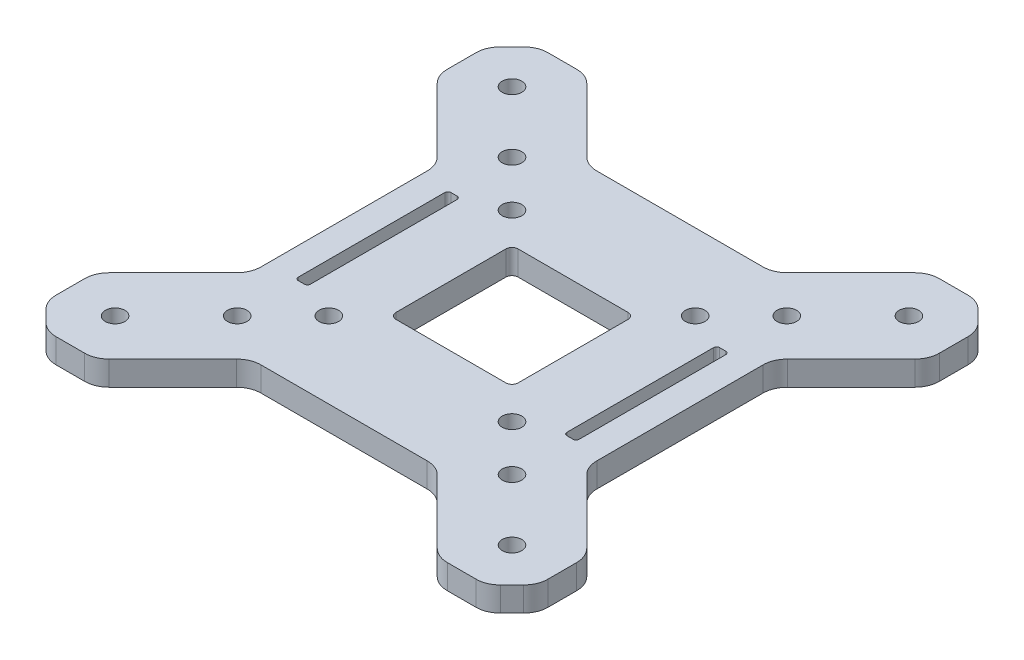
from build123d import *

# Parameters (mm, degrees)
BOSS_EXTRUDE1_DEPTH = 4
FILLET1_R           = 4
SKETCH2_W           = 20
SKETCH2_H           = 20
SKETCH2_W_2         = 2
SKETCH2_H_2         = 25
CUT_EXTRUDE1_DEPTH  = 4
FILLET2_R           = 1
FILLET3_R           = 0.5
FILLET4_R           = 0.5


with BuildPart() as part:
    # Sketch1 → Boss-Extrude1 (new body)
    with BuildSketch(Plane(origin=(0, 0, 0), x_dir=(1, 0, 0), z_dir=(0, 1, 0))):
        with BuildLine():
            Line((-32.5, -30.9), (-32.5, -23.50217812))
            ThreePointArc((-32.5, -23.50217812), (-33.389914379, -22.768338823), (-34.291390983, -22.048750296))
            Line((-34.291390983, -22.048750296), (-40.278174593, -28.035533906))
            Line((-40.278174593, -28.035533906), (-40.278174593, -36.035533906))
            Line((-40.278174593, -36.035533906), (-38.156854249, -38.156854249))
            Line((-38.156854249, -38.156854249), (-33.63137085, -33.63137085))
            ThreePointArc((-33.63137085, -33.63137085), (-33.978207252, -31.887706508), (-32.5, -30.9))
        make_face()
        with BuildLine():
            ThreePointArc((-22.048750296, -34.291390983), (-22.768338823, -33.389914379), (-23.50217812, -32.5))
            Line((-23.50217812, -32.5), (-30.9, -32.5))
            ThreePointArc((-30.9, -32.5), (-31.887706508, -33.978207252), (-33.63137085, -33.63137085))
            Line((-33.63137085, -33.63137085), (-38.156854249, -38.156854249))
            Line((-38.156854249, -38.156854249), (-36.035533906, -40.278174593))
            Line((-36.035533906, -40.278174593), (-28.035533906, -40.278174593))
            Line((-28.035533906, -40.278174593), (-22.048750296, -34.291390983))
        make_face()
        with BuildLine():
            Line((-32.5, -23.50217812), (-32.5, -20.257359313))
            Line((-32.5, -20.257359313), (-34.291390983, -22.048750296))
            ThreePointArc((-34.291390983, -22.048750296), (-33.389914379, -22.768338823), (-32.5, -23.50217812))
        make_face()
        with BuildLine():
            Line((-22.048750296, -34.291390983), (-20.257359313, -32.5))
            Line((-20.257359313, -32.5), (-23.50217812, -32.5))
            ThreePointArc((-23.50217812, -32.5), (-22.768338823, -33.389914379), (-22.048750296, -34.291390983))
        make_face()
        with BuildLine():
            Line((-15.257359313, -27.5), (-27.5, -27.5))
            Line((-27.5, -27.5), (-27.803300859, -27.803300859))
            ThreePointArc((-27.803300859, -27.803300859), (-25.601143489, -30.104400069), (-23.50217812, -32.5))
            Line((-23.50217812, -32.5), (-20.257359313, -32.5))
            Line((-20.257359313, -32.5), (-15.257359313, -27.5))
        make_face()
        with BuildLine():
            Line((-27.803300859, -27.803300859), (-27.5, -27.5))
            Line((-27.5, -27.5), (-27.5, -15.257359313))
            Line((-27.5, -15.257359313), (-32.5, -20.257359313))
            Line((-32.5, -20.257359313), (-32.5, -23.50217812))
            ThreePointArc((-32.5, -23.50217812), (-30.104400069, -25.601143489), (-27.803300859, -27.803300859))
        make_face()
        with BuildLine():
            Line((-31.36862915, -31.36862915), (-27.803300859, -27.803300859))
            ThreePointArc((-27.803300859, -27.803300859), (-30.104400069, -25.601143489), (-32.5, -23.50217812))
            Line((-32.5, -23.50217812), (-32.5, -30.9))
            ThreePointArc((-32.5, -30.9), (-31.887706508, -31.021792748), (-31.36862915, -31.36862915))
        make_face()
        with BuildLine():
            ThreePointArc((-23.50217812, -32.5), (-25.601143489, -30.104400069), (-27.803300859, -27.803300859))
            Line((-27.803300859, -27.803300859), (-31.36862915, -31.36862915))
            ThreePointArc((-31.36862915, -31.36862915), (-31.021792748, -31.887706508), (-30.9, -32.5))
            Line((-30.9, -32.5), (-23.50217812, -32.5))
        make_face()
        with BuildLine():
            ThreePointArc((-23.63137085, -23.63137085), (-23.978207252, -21.887706508), (-22.5, -20.9))
            Line((-22.5, -20.9), (-22.5, -10.257359313))
            Line((-22.5, -10.257359313), (-27.5, -15.257359313))
            Line((-27.5, -15.257359313), (-27.5, -27.5))
            Line((-27.5, -27.5), (-23.63137085, -23.63137085))
        make_face()
        with BuildLine():
            Line((-10.257359313, -22.5), (-20.9, -22.5))
            ThreePointArc((-20.9, -22.5), (-21.887706508, -23.978207252), (-23.63137085, -23.63137085))
            Line((-23.63137085, -23.63137085), (-27.5, -27.5))
            Line((-27.5, -27.5), (-15.257359313, -27.5))
            Line((-15.257359313, -27.5), (-10.257359313, -22.5))
        make_face()
        with BuildLine():
            ThreePointArc((-16.13137085, -16.13137085), (-16.478207252, -14.387706508), (-15, -13.4))
            Line((-15, -13.4), (-15, 13.4))
            ThreePointArc((-15, 13.4), (-16.478207252, 14.387706508), (-16.13137085, 16.13137085))
            Line((-16.13137085, 16.13137085), (-21.36862915, 21.36862915))
            ThreePointArc((-21.36862915, 21.36862915), (-21.887706508, 21.021792748), (-22.5, 20.9))
            Line((-22.5, 20.9), (-22.5, 10.257359313))
            Line((-22.5, 10.257359313), (-22.5, -10.257359313))
            Line((-22.5, -10.257359313), (-22.5, -20.9))
            ThreePointArc((-22.5, -20.9), (-21.887706508, -21.021792748), (-21.36862915, -21.36862915))
            Line((-21.36862915, -21.36862915), (-16.13137085, -16.13137085))
        make_face()
        with BuildLine():
            ThreePointArc((16.13137085, -16.13137085), (14.387706508, -16.478207252), (13.4, -15))
            Line((13.4, -15), (-13.4, -15))
            ThreePointArc((-13.4, -15), (-14.387706508, -16.478207252), (-16.13137085, -16.13137085))
            Line((-16.13137085, -16.13137085), (-21.36862915, -21.36862915))
            ThreePointArc((-21.36862915, -21.36862915), (-21.021792748, -21.887706508), (-20.9, -22.5))
            Line((-20.9, -22.5), (-10.257359313, -22.5))
            Line((-10.257359313, -22.5), (10.257359313, -22.5))
            Line((10.257359313, -22.5), (20.9, -22.5))
            ThreePointArc((20.9, -22.5), (21.021792748, -21.887706508), (21.36862915, -21.36862915))
            Line((21.36862915, -21.36862915), (16.13137085, -16.13137085))
        make_face()
        Polygon((-27.5, -15.257359313), (-22.5, -10.257359313), (-22.5, 10.257359313), (-27.5, 15.257359313), align=None)
        Polygon((15.257359313, -27.5), (10.257359313, -22.5), (-10.257359313, -22.5), (-15.257359313, -27.5), align=None)
        with BuildLine():
            ThreePointArc((23.63137085, -23.63137085), (21.887706508, -23.978207252), (20.9, -22.5))
            Line((20.9, -22.5), (10.257359313, -22.5))
            Line((10.257359313, -22.5), (15.257359313, -27.5))
            Line((15.257359313, -27.5), (27.5, -27.5))
            Line((27.5, -27.5), (23.63137085, -23.63137085))
        make_face()
        with BuildLine():
            Line((22.5, -10.257359313), (22.5, -20.9))
            ThreePointArc((22.5, -20.9), (23.63137085, -21.36862915), (24.1, -22.5))
            ThreePointArc((24.1, -22.5), (23.978207252, -23.112293492), (23.63137085, -23.63137085))
            Line((23.63137085, -23.63137085), (27.5, -27.5))
            Line((27.5, -27.5), (27.5, -15.257359313))
            Line((27.5, -15.257359313), (22.5, -10.257359313))
        make_face()
        with BuildLine():
            ThreePointArc((16.6, 15), (16.13137085, 13.86862915), (15, 13.4))
            Line((15, 13.4), (15, -13.4))
            ThreePointArc((15, -13.4), (16.13137085, -13.86862915), (16.6, -15))
            ThreePointArc((16.6, -15), (16.478207252, -15.612293492), (16.13137085, -16.13137085))
            Line((16.13137085, -16.13137085), (21.36862915, -21.36862915))
            ThreePointArc((21.36862915, -21.36862915), (21.887706508, -21.021792748), (22.5, -20.9))
            Line((22.5, -20.9), (22.5, -10.257359313))
            Line((22.5, -10.257359313), (22.5, 10.257359313))
            Line((22.5, 10.257359313), (22.5, 20.9))
            ThreePointArc((22.5, 20.9), (21.887706508, 21.021792748), (21.36862915, 21.36862915))
            Line((21.36862915, 21.36862915), (16.13137085, 16.13137085))
            ThreePointArc((16.13137085, 16.13137085), (16.478207252, 15.612293492), (16.6, 15))
        make_face()
        Polygon((27.5, 15.257359313), (22.5, 10.257359313), (22.5, -10.257359313), (27.5, -15.257359313), align=None)
        with BuildLine():
            Line((27.5, -15.257359313), (27.5, -27.5))
            Line((27.5, -27.5), (27.803300859, -27.803300859))
            ThreePointArc((27.803300859, -27.803300859), (30.104400069, -25.601143489), (32.5, -23.50217812))
            Line((32.5, -23.50217812), (32.5, -20.257359313))
            Line((32.5, -20.257359313), (27.5, -15.257359313))
        make_face()
        with BuildLine():
            Line((27.803300859, -27.803300859), (27.5, -27.5))
            Line((27.5, -27.5), (15.257359313, -27.5))
            Line((15.257359313, -27.5), (20.257359313, -32.5))
            Line((20.257359313, -32.5), (23.50217812, -32.5))
            ThreePointArc((23.50217812, -32.5), (25.601143489, -30.104400069), (27.803300859, -27.803300859))
        make_face()
        with BuildLine():
            Line((31.36862915, -31.36862915), (27.803300859, -27.803300859))
            ThreePointArc((27.803300859, -27.803300859), (25.601143489, -30.104400069), (23.50217812, -32.5))
            Line((23.50217812, -32.5), (30.9, -32.5))
            ThreePointArc((30.9, -32.5), (31.021792748, -31.887706508), (31.36862915, -31.36862915))
        make_face()
        with BuildLine():
            ThreePointArc((32.5, -23.50217812), (30.104400069, -25.601143489), (27.803300859, -27.803300859))
            Line((27.803300859, -27.803300859), (31.36862915, -31.36862915))
            ThreePointArc((31.36862915, -31.36862915), (31.887706508, -31.021792748), (32.5, -30.9))
            Line((32.5, -30.9), (32.5, -23.50217812))
        make_face()
        with BuildLine():
            Line((30.9, -32.5), (23.50217812, -32.5))
            ThreePointArc((23.50217812, -32.5), (22.768338823, -33.389914379), (22.048750296, -34.291390983))
            Line((22.048750296, -34.291390983), (28.035533906, -40.278174593))
            Line((28.035533906, -40.278174593), (36.035533906, -40.278174593))
            Line((36.035533906, -40.278174593), (38.156854249, -38.156854249))
            Line((38.156854249, -38.156854249), (33.63137085, -33.63137085))
            ThreePointArc((33.63137085, -33.63137085), (31.887706508, -33.978207252), (30.9, -32.5))
        make_face()
        with BuildLine():
            Line((23.50217812, -32.5), (20.257359313, -32.5))
            Line((20.257359313, -32.5), (22.048750296, -34.291390983))
            ThreePointArc((22.048750296, -34.291390983), (22.768338823, -33.389914379), (23.50217812, -32.5))
        make_face()
        with BuildLine():
            Line((34.291390983, -22.048750296), (32.5, -20.257359313))
            Line((32.5, -20.257359313), (32.5, -23.50217812))
            ThreePointArc((32.5, -23.50217812), (33.389914379, -22.768338823), (34.291390983, -22.048750296))
        make_face()
        with BuildLine():
            ThreePointArc((34.291390983, -22.048750296), (33.389914379, -22.768338823), (32.5, -23.50217812))
            Line((32.5, -23.50217812), (32.5, -30.9))
            ThreePointArc((32.5, -30.9), (33.63137085, -31.36862915), (34.1, -32.5))
            ThreePointArc((34.1, -32.5), (33.978207252, -33.112293492), (33.63137085, -33.63137085))
            Line((33.63137085, -33.63137085), (38.156854249, -38.156854249))
            Line((38.156854249, -38.156854249), (40.278174593, -36.035533906))
            Line((40.278174593, -36.035533906), (40.278174593, -28.035533906))
            Line((40.278174593, -28.035533906), (34.291390983, -22.048750296))
        make_face()
        with BuildLine():
            Line((13.86862915, -13.86862915), (0, 0))
            Line((0, 0), (-13.86862915, -13.86862915))
            ThreePointArc((-13.86862915, -13.86862915), (-13.521792748, -14.387706508), (-13.4, -15))
            Line((-13.4, -15), (13.4, -15))
            ThreePointArc((13.4, -15), (13.521792748, -14.387706508), (13.86862915, -13.86862915))
        make_face()
        with BuildLine():
            Line((-13.86862915, -13.86862915), (0, 0))
            Line((0, 0), (-13.86862915, 13.86862915))
            ThreePointArc((-13.86862915, 13.86862915), (-14.387706508, 13.521792748), (-15, 13.4))
            Line((-15, 13.4), (-15, -13.4))
            ThreePointArc((-15, -13.4), (-14.387706508, -13.521792748), (-13.86862915, -13.86862915))
        make_face()
        with BuildLine():
            Line((-13.86862915, 13.86862915), (0, 0))
            Line((0, 0), (13.86862915, 13.86862915))
            ThreePointArc((13.86862915, 13.86862915), (13.521792748, 14.387706508), (13.4, 15))
            Line((13.4, 15), (-13.4, 15))
            ThreePointArc((-13.4, 15), (-13.521792748, 14.387706508), (-13.86862915, 13.86862915))
        make_face()
        with BuildLine():
            Line((13.86862915, 13.86862915), (0, 0))
            Line((0, 0), (13.86862915, -13.86862915))
            ThreePointArc((13.86862915, -13.86862915), (14.387706508, -13.521792748), (15, -13.4))
            Line((15, -13.4), (15, 13.4))
            ThreePointArc((15, 13.4), (14.387706508, 13.521792748), (13.86862915, 13.86862915))
        make_face()
        with BuildLine():
            Line((-13.4, 15), (13.4, 15))
            ThreePointArc((13.4, 15), (14.387706508, 16.478207252), (16.13137085, 16.13137085))
            Line((16.13137085, 16.13137085), (21.36862915, 21.36862915))
            ThreePointArc((21.36862915, 21.36862915), (21.021792748, 21.887706508), (20.9, 22.5))
            Line((20.9, 22.5), (10.257359313, 22.5))
            Line((10.257359313, 22.5), (-10.257359313, 22.5))
            Line((-10.257359313, 22.5), (-20.9, 22.5))
            ThreePointArc((-20.9, 22.5), (-21.021792748, 21.887706508), (-21.36862915, 21.36862915))
            Line((-21.36862915, 21.36862915), (-16.13137085, 16.13137085))
            ThreePointArc((-16.13137085, 16.13137085), (-14.387706508, 16.478207252), (-13.4, 15))
        make_face()
        Polygon((-10.257359313, 22.5), (10.257359313, 22.5), (15.257359313, 27.5), (-15.257359313, 27.5), align=None)
        with BuildLine():
            ThreePointArc((-23.63137085, 23.63137085), (-21.887706508, 23.978207252), (-20.9, 22.5))
            Line((-20.9, 22.5), (-10.257359313, 22.5))
            Line((-10.257359313, 22.5), (-15.257359313, 27.5))
            Line((-15.257359313, 27.5), (-27.5, 27.5))
            Line((-27.5, 27.5), (-23.63137085, 23.63137085))
        make_face()
        with BuildLine():
            Line((10.257359313, 22.5), (20.9, 22.5))
            ThreePointArc((20.9, 22.5), (21.887706508, 23.978207252), (23.63137085, 23.63137085))
            Line((23.63137085, 23.63137085), (27.5, 27.5))
            Line((27.5, 27.5), (15.257359313, 27.5))
            Line((15.257359313, 27.5), (10.257359313, 22.5))
        make_face()
        with BuildLine():
            ThreePointArc((24.1, 22.5), (23.63137085, 21.36862915), (22.5, 20.9))
            Line((22.5, 20.9), (22.5, 10.257359313))
            Line((22.5, 10.257359313), (27.5, 15.257359313))
            Line((27.5, 15.257359313), (27.5, 27.5))
            Line((27.5, 27.5), (23.63137085, 23.63137085))
            ThreePointArc((23.63137085, 23.63137085), (23.978207252, 23.112293492), (24.1, 22.5))
        make_face()
        with BuildLine():
            Line((27.803300859, 27.803300859), (27.5, 27.5))
            Line((27.5, 27.5), (27.5, 15.257359313))
            Line((27.5, 15.257359313), (32.5, 20.257359313))
            Line((32.5, 20.257359313), (32.5, 23.50217812))
            ThreePointArc((32.5, 23.50217812), (30.104400069, 25.601143489), (27.803300859, 27.803300859))
        make_face()
        with BuildLine():
            Line((15.257359313, 27.5), (27.5, 27.5))
            Line((27.5, 27.5), (27.803300859, 27.803300859))
            ThreePointArc((27.803300859, 27.803300859), (25.601143489, 30.104400069), (23.50217812, 32.5))
            Line((23.50217812, 32.5), (20.257359313, 32.5))
            Line((20.257359313, 32.5), (15.257359313, 27.5))
        make_face()
        with BuildLine():
            Line((-27.5, 15.257359313), (-27.5, 27.5))
            Line((-27.5, 27.5), (-27.803300859, 27.803300859))
            ThreePointArc((-27.803300859, 27.803300859), (-30.104400069, 25.601143489), (-32.5, 23.50217812))
            Line((-32.5, 23.50217812), (-32.5, 20.257359313))
            Line((-32.5, 20.257359313), (-27.5, 15.257359313))
        make_face()
        with BuildLine():
            Line((-31.36862915, 31.36862915), (-27.803300859, 27.803300859))
            ThreePointArc((-27.803300859, 27.803300859), (-25.601143489, 30.104400069), (-23.50217812, 32.5))
            Line((-23.50217812, 32.5), (-30.9, 32.5))
            ThreePointArc((-30.9, 32.5), (-31.021792748, 31.887706508), (-31.36862915, 31.36862915))
        make_face()
        with BuildLine():
            Line((-22.5, 10.257359313), (-22.5, 20.9))
            ThreePointArc((-22.5, 20.9), (-23.978207252, 21.887706508), (-23.63137085, 23.63137085))
            Line((-23.63137085, 23.63137085), (-27.5, 27.5))
            Line((-27.5, 27.5), (-27.5, 15.257359313))
            Line((-27.5, 15.257359313), (-22.5, 10.257359313))
        make_face()
        with BuildLine():
            Line((-27.803300859, 27.803300859), (-27.5, 27.5))
            Line((-27.5, 27.5), (-15.257359313, 27.5))
            Line((-15.257359313, 27.5), (-20.257359313, 32.5))
            Line((-20.257359313, 32.5), (-23.50217812, 32.5))
            ThreePointArc((-23.50217812, 32.5), (-25.601143489, 30.104400069), (-27.803300859, 27.803300859))
        make_face()
        with BuildLine():
            ThreePointArc((-32.5, 23.50217812), (-30.104400069, 25.601143489), (-27.803300859, 27.803300859))
            Line((-27.803300859, 27.803300859), (-31.36862915, 31.36862915))
            ThreePointArc((-31.36862915, 31.36862915), (-31.887706508, 31.021792748), (-32.5, 30.9))
            Line((-32.5, 30.9), (-32.5, 23.50217812))
        make_face()
        with BuildLine():
            ThreePointArc((-34.291390983, 22.048750296), (-33.389914379, 22.768338823), (-32.5, 23.50217812))
            Line((-32.5, 23.50217812), (-32.5, 30.9))
            ThreePointArc((-32.5, 30.9), (-33.978207252, 31.887706508), (-33.63137085, 33.63137085))
            Line((-33.63137085, 33.63137085), (-38.156854249, 38.156854249))
            Line((-38.156854249, 38.156854249), (-40.278174593, 36.035533906))
            Line((-40.278174593, 36.035533906), (-40.278174593, 28.035533906))
            Line((-40.278174593, 28.035533906), (-34.291390983, 22.048750296))
        make_face()
        with BuildLine():
            Line((-30.9, 32.5), (-23.50217812, 32.5))
            ThreePointArc((-23.50217812, 32.5), (-22.768338823, 33.389914379), (-22.048750296, 34.291390983))
            Line((-22.048750296, 34.291390983), (-28.035533906, 40.278174593))
            Line((-28.035533906, 40.278174593), (-36.035533906, 40.278174593))
            Line((-36.035533906, 40.278174593), (-38.156854249, 38.156854249))
            Line((-38.156854249, 38.156854249), (-33.63137085, 33.63137085))
            ThreePointArc((-33.63137085, 33.63137085), (-31.887706508, 33.978207252), (-30.9, 32.5))
        make_face()
        with BuildLine():
            Line((-23.50217812, 32.5), (-20.257359313, 32.5))
            Line((-20.257359313, 32.5), (-22.048750296, 34.291390983))
            ThreePointArc((-22.048750296, 34.291390983), (-22.768338823, 33.389914379), (-23.50217812, 32.5))
        make_face()
        with BuildLine():
            Line((-34.291390983, 22.048750296), (-32.5, 20.257359313))
            Line((-32.5, 20.257359313), (-32.5, 23.50217812))
            ThreePointArc((-32.5, 23.50217812), (-33.389914379, 22.768338823), (-34.291390983, 22.048750296))
        make_face()
        with BuildLine():
            ThreePointArc((23.50217812, 32.5), (25.601143489, 30.104400069), (27.803300859, 27.803300859))
            Line((27.803300859, 27.803300859), (31.36862915, 31.36862915))
            ThreePointArc((31.36862915, 31.36862915), (31.021792748, 31.887706508), (30.9, 32.5))
            Line((30.9, 32.5), (23.50217812, 32.5))
        make_face()
        with BuildLine():
            ThreePointArc((22.048750296, 34.291390983), (22.768338823, 33.389914379), (23.50217812, 32.5))
            Line((23.50217812, 32.5), (30.9, 32.5))
            ThreePointArc((30.9, 32.5), (31.887706508, 33.978207252), (33.63137085, 33.63137085))
            Line((33.63137085, 33.63137085), (38.156854249, 38.156854249))
            Line((38.156854249, 38.156854249), (36.035533906, 40.278174593))
            Line((36.035533906, 40.278174593), (28.035533906, 40.278174593))
            Line((28.035533906, 40.278174593), (22.048750296, 34.291390983))
        make_face()
        with BuildLine():
            Line((22.048750296, 34.291390983), (20.257359313, 32.5))
            Line((20.257359313, 32.5), (23.50217812, 32.5))
            ThreePointArc((23.50217812, 32.5), (22.768338823, 33.389914379), (22.048750296, 34.291390983))
        make_face()
        with BuildLine():
            Line((32.5, 23.50217812), (32.5, 20.257359313))
            Line((32.5, 20.257359313), (34.291390983, 22.048750296))
            ThreePointArc((34.291390983, 22.048750296), (33.389914379, 22.768338823), (32.5, 23.50217812))
        make_face()
        with BuildLine():
            Line((32.5, 30.9), (32.5, 23.50217812))
            ThreePointArc((32.5, 23.50217812), (33.389914379, 22.768338823), (34.291390983, 22.048750296))
            Line((34.291390983, 22.048750296), (40.278174593, 28.035533906))
            Line((40.278174593, 28.035533906), (40.278174593, 36.035533906))
            Line((40.278174593, 36.035533906), (38.156854249, 38.156854249))
            Line((38.156854249, 38.156854249), (33.63137085, 33.63137085))
            ThreePointArc((33.63137085, 33.63137085), (33.978207252, 33.112293492), (34.1, 32.5))
            ThreePointArc((34.1, 32.5), (33.63137085, 31.36862915), (32.5, 30.9))
        make_face()
        with BuildLine():
            Line((31.36862915, 31.36862915), (27.803300859, 27.803300859))
            ThreePointArc((27.803300859, 27.803300859), (30.104400069, 25.601143489), (32.5, 23.50217812))
            Line((32.5, 23.50217812), (32.5, 30.9))
            ThreePointArc((32.5, 30.9), (31.887706508, 31.021792748), (31.36862915, 31.36862915))
        make_face()
    extrude(amount=BOSS_EXTRUDE1_DEPTH)

    # Fillet1
    fillet1_edges = [part.edges().sort_by_distance(p)[0] for p in [
        (28.035533906, 2, 40.278174593),
        (15.257359313, 2, 27.5),
        (-15.257359313, 2, 27.5),
        (-28.035533906, 2, 40.278174593),
        (-36.035533906, 2, 40.278174593),
        (-40.278174593, 2, 36.035533906),
        (-40.278174593, 2, 28.035533906),
        (-27.5, 2, 15.257359313),
        (-27.5, 2, -15.257359313),
        (-40.278174593, 2, -28.035533906),
        (-40.278174593, 2, -36.035533906),
        (-36.035533906, 2, -40.278174593),
        (-28.035533906, 2, -40.278174593),
        (-15.257359313, 2, -27.5),
        (15.257359313, 2, -27.5),
        (28.035533906, 2, -40.278174593),
        (36.035533906, 2, -40.278174593),
        (40.278174593, 2, -36.035533906),
        (40.278174593, 2, -28.035533906),
        (27.5, 2, -15.257359313),
        (27.5, 2, 15.257359313),
        (40.278174593, 2, 28.035533906),
        (40.278174593, 2, 36.035533906),
        (36.035533906, 2, 40.278174593),
    ]]
    fillet(fillet1_edges, radius=FILLET1_R)

    # Sketch2 → Cut-Extrude1 (cut)
    with BuildSketch(Plane(origin=(0, 4, 0), x_dir=(1, 0, 0), z_dir=(0, 1, 0))):
        Rectangle(SKETCH2_W, SKETCH2_H)
        with Locations((-22, 0)):
            Rectangle(SKETCH2_W_2, SKETCH2_H_2)
        with Locations((22, 0)):
            Rectangle(SKETCH2_W_2, SKETCH2_H_2)
    extrude(amount=-CUT_EXTRUDE1_DEPTH, mode=Mode.SUBTRACT)

    # Fillet2
    fillet2_edges = [part.edges().sort_by_distance(p)[0] for p in [
        (10, 2, 10),
        (-10, 2, 10),
        (-10, 2, -10),
        (10, 2, -10),
    ]]
    fillet(fillet2_edges, radius=FILLET2_R)

    # Fillet3
    fillet3_edges = [part.edges().sort_by_distance(p)[0] for p in [
        (-21, 2, -12.5),
        (-21, 2, 12.5),
        (-23, 2, 12.5),
        (-23, 2, -12.5),
    ]]
    fillet(fillet3_edges, radius=FILLET3_R)

    # Fillet4
    fillet4_edges = [part.edges().sort_by_distance(p)[0] for p in [
        (23, 2, -12.5),
        (23, 2, 12.5),
        (21, 2, 12.5),
        (21, 2, -12.5),
    ]]
    fillet(fillet4_edges, radius=FILLET4_R)


solid = part.part
